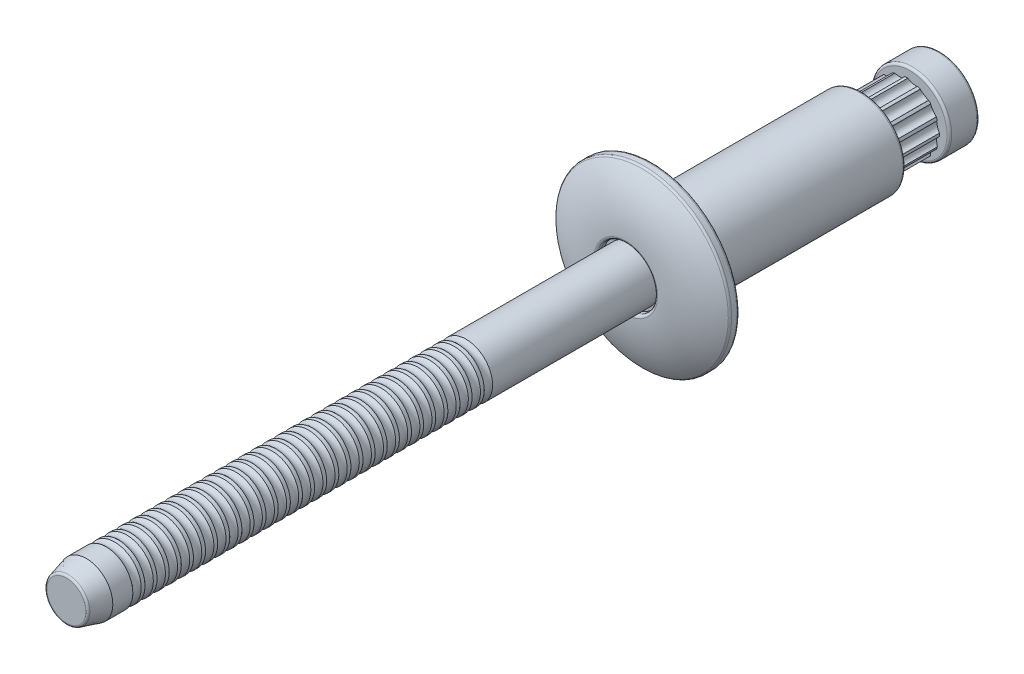
from build123d import *

# Parameters (mm, degrees)
FILLET1_R          = 0.142875
CHAMFER1_SIZE      = 0.14478
CHAMFER1_SIZE2     = 0.250766316
FILLET2_R          = 0.127
CUT_EXTRUDE1_DEPTH = 47.474786555
CIRPATTERN1_COUNT  = 16
FILLET3_R          = 0.1905


with BuildPart() as part:
    # Sketch2 → Revolve1 (revolve)
    with BuildSketch(Plane(origin=(0, 0, 0), x_dir=(0, 0, -1), z_dir=(1, 0, 0)), mode=Mode.PRIVATE) as revolve1_sk:
        with BuildLine():
            Line((6.77545, 1.59258), (6.55828, 1.59258))
            ThreePointArc((6.55828, 1.59258), (6.45590508, 1.63498508), (6.4135, 1.73736))
            ThreePointArc((6.4135, 1.73736), (6.654199565, 3.321427925), (7.35457, 4.7625))
            Line((7.35457, 4.7625), (7.8613, 4.7625))
            Line((7.8613, 4.7625), (7.8613, 2.38125))
            Line((7.8613, 2.38125), (19.2913, 2.38125))
            Line((19.2913, 2.38125), (19.2913, 1.4478))
            Line((19.2913, 1.4478), (6.77545, 1.4478))
            Line((6.77545, 1.4478), (6.77545, 1.59258))
        make_face()
    revolve(revolve1_sk.sketch.rotate(Axis((0, 0, 24.0665), (0, 0, -1)), 180), axis=Axis((0, 0, 24.0665), (0, 0, -1)))

    # Fillet1
    fillet1_edges = [part.edges().sort_by_distance(p)[0] for p in [
        (0, 4.7625, -7.35457),
        (0, 4.7625, -7.8613),
        (0, 2.38125, -19.2913),
    ]]
    fillet(fillet1_edges, radius=FILLET1_R)

    # Chamfer1
    chamfer1_edges = [part.edges().sort_by_distance(p)[0] for p in [
        (0, 1.4478, -19.2913),
    ]]
    chamfer1_side = [part.faces().sort_by_distance(p)[0] for p in [
        (0, 1.4478, -13.033375),
    ]]
    chamfer(chamfer1_edges, length=CHAMFER1_SIZE, length2=CHAMFER1_SIZE2, reference=chamfer1_side[0])

    # Fillet3
    fillet3_edges = [part.edges().sort_by_distance(p)[0] for p in [
        (0, 2.38125, -7.8613),
    ]]
    fillet(fillet3_edges, radius=FILLET3_R)


with BuildPart() as body_2:
    # Sketch3 → Revolve2 (revolve)
    with BuildSketch(Plane(origin=(0, 0, 0), x_dir=(0, 0, -1), z_dir=(1, 0, 0))):
        Polygon((-24.0665, 1.15824), (-22.985847368, 1.4478), (6.4135, 1.4478), (19.2913, 1.4478), (19.50027193, 1.80975), (21.70868807, 1.80975), (21.91766, 1.4478), (21.91766, 2.143125), (23.49787638, 2.143125), (24.0665, 1.15824), (24.0665, 0), (-24.0665, 0), align=None)
    revolve(axis=Axis((0, 0, -24.0665), (0, 0, 1)))

    # Fillet2
    fillet2_edges = [body_2.edges().sort_by_distance(p)[0] for p in [
        (0, -2.143125, -21.91766),
        (0, -2.143125, -23.49787638),
        (0, -1.15824, 24.0665),
    ]]
    fillet(fillet2_edges, radius=FILLET2_R)

    # Sketch4 → Cut-Revolve1 (revolve, cut)
    with BuildSketch(Plane(origin=(0, 0, 0), x_dir=(0, 0, -1), z_dir=(1, 0, 0))):
        with BuildLine():
            Line((-21.8948, 1.4478), (-21.8948, 1.705155474))
            Line((-21.8948, 1.705155474), (-21.4376, 1.705155474))
            Line((-21.4376, 1.705155474), (-21.4376, 1.4478))
            ThreePointArc((-21.4376, 1.4478), (-21.6662, 1.360932), (-21.8948, 1.4478))
        make_face()
        with BuildLine():
            Line((-20.7772, 1.705155474), (-20.7772, 1.4478))
            ThreePointArc((-20.7772, 1.4478), (-21.0058, 1.360932), (-21.2344, 1.4478))
            Line((-21.2344, 1.4478), (-21.2344, 1.705155474))
            Line((-21.2344, 1.705155474), (-20.7772, 1.705155474))
        make_face()
        with BuildLine():
            Line((-20.1168, 1.705155474), (-20.1168, 1.4478))
            ThreePointArc((-20.1168, 1.4478), (-20.3454, 1.360932), (-20.574, 1.4478))
            Line((-20.574, 1.4478), (-20.574, 1.705155474))
            Line((-20.574, 1.705155474), (-20.1168, 1.705155474))
        make_face()
        with BuildLine():
            Line((-19.4564, 1.705155474), (-19.4564, 1.4478))
            ThreePointArc((-19.4564, 1.4478), (-19.685, 1.360932), (-19.9136, 1.4478))
            Line((-19.9136, 1.4478), (-19.9136, 1.705155474))
            Line((-19.9136, 1.705155474), (-19.4564, 1.705155474))
        make_face()
        with BuildLine():
            Line((-18.796, 1.705155474), (-18.796, 1.4478))
            ThreePointArc((-18.796, 1.4478), (-19.0246, 1.360932), (-19.2532, 1.4478))
            Line((-19.2532, 1.4478), (-19.2532, 1.705155474))
            Line((-19.2532, 1.705155474), (-18.796, 1.705155474))
        make_face()
        with BuildLine():
            Line((-18.1356, 1.705155474), (-18.1356, 1.4478))
            ThreePointArc((-18.1356, 1.4478), (-18.3642, 1.360932), (-18.5928, 1.4478))
            Line((-18.5928, 1.4478), (-18.5928, 1.705155474))
            Line((-18.5928, 1.705155474), (-18.1356, 1.705155474))
        make_face()
        with BuildLine():
            Line((-17.4752, 1.705155474), (-17.4752, 1.4478))
            ThreePointArc((-17.4752, 1.4478), (-17.7038, 1.360932), (-17.9324, 1.4478))
            Line((-17.9324, 1.4478), (-17.9324, 1.705155474))
            Line((-17.9324, 1.705155474), (-17.4752, 1.705155474))
        make_face()
        with BuildLine():
            Line((-16.8148, 1.705155474), (-16.8148, 1.4478))
            ThreePointArc((-16.8148, 1.4478), (-17.0434, 1.360932), (-17.272, 1.4478))
            Line((-17.272, 1.4478), (-17.272, 1.705155474))
            Line((-17.272, 1.705155474), (-16.8148, 1.705155474))
        make_face()
        with BuildLine():
            Line((-16.1544, 1.705155474), (-16.1544, 1.4478))
            ThreePointArc((-16.1544, 1.4478), (-16.383, 1.360932), (-16.6116, 1.4478))
            Line((-16.6116, 1.4478), (-16.6116, 1.705155474))
            Line((-16.6116, 1.705155474), (-16.1544, 1.705155474))
        make_face()
        with BuildLine():
            Line((-15.494, 1.705155474), (-15.494, 1.4478))
            ThreePointArc((-15.494, 1.4478), (-15.7226, 1.360932), (-15.9512, 1.4478))
            Line((-15.9512, 1.4478), (-15.9512, 1.705155474))
            Line((-15.9512, 1.705155474), (-15.494, 1.705155474))
        make_face()
        with BuildLine():
            Line((-14.8336, 1.705155474), (-14.8336, 1.4478))
            ThreePointArc((-14.8336, 1.4478), (-15.0622, 1.360932), (-15.2908, 1.4478))
            Line((-15.2908, 1.4478), (-15.2908, 1.705155474))
            Line((-15.2908, 1.705155474), (-14.8336, 1.705155474))
        make_face()
        with BuildLine():
            Line((-14.1732, 1.705155474), (-14.1732, 1.4478))
            ThreePointArc((-14.1732, 1.4478), (-14.4018, 1.360932), (-14.6304, 1.4478))
            Line((-14.6304, 1.4478), (-14.6304, 1.705155474))
            Line((-14.6304, 1.705155474), (-14.1732, 1.705155474))
        make_face()
        with BuildLine():
            Line((-13.5128, 1.705155474), (-13.5128, 1.4478))
            ThreePointArc((-13.5128, 1.4478), (-13.7414, 1.360932), (-13.97, 1.4478))
            Line((-13.97, 1.4478), (-13.97, 1.705155474))
            Line((-13.97, 1.705155474), (-13.5128, 1.705155474))
        make_face()
        with BuildLine():
            Line((-12.8524, 1.705155474), (-12.8524, 1.4478))
            ThreePointArc((-12.8524, 1.4478), (-13.081, 1.360932), (-13.3096, 1.4478))
            Line((-13.3096, 1.4478), (-13.3096, 1.705155474))
            Line((-13.3096, 1.705155474), (-12.8524, 1.705155474))
        make_face()
        with BuildLine():
            Line((-12.192, 1.705155474), (-12.192, 1.4478))
            ThreePointArc((-12.192, 1.4478), (-12.4206, 1.360932), (-12.6492, 1.4478))
            Line((-12.6492, 1.4478), (-12.6492, 1.705155474))
            Line((-12.6492, 1.705155474), (-12.192, 1.705155474))
        make_face()
        with BuildLine():
            Line((-11.5316, 1.705155474), (-11.5316, 1.4478))
            ThreePointArc((-11.5316, 1.4478), (-11.7602, 1.360932), (-11.9888, 1.4478))
            Line((-11.9888, 1.4478), (-11.9888, 1.705155474))
            Line((-11.9888, 1.705155474), (-11.5316, 1.705155474))
        make_face()
        with BuildLine():
            Line((-10.8712, 1.705155474), (-10.8712, 1.4478))
            ThreePointArc((-10.8712, 1.4478), (-11.0998, 1.360932), (-11.3284, 1.4478))
            Line((-11.3284, 1.4478), (-11.3284, 1.705155474))
            Line((-11.3284, 1.705155474), (-10.8712, 1.705155474))
        make_face()
        with BuildLine():
            Line((-10.2108, 1.705155474), (-10.2108, 1.4478))
            ThreePointArc((-10.2108, 1.4478), (-10.4394, 1.360932), (-10.668, 1.4478))
            Line((-10.668, 1.4478), (-10.668, 1.705155474))
            Line((-10.668, 1.705155474), (-10.2108, 1.705155474))
        make_face()
        with BuildLine():
            Line((-9.5504, 1.705155474), (-9.5504, 1.4478))
            ThreePointArc((-9.5504, 1.4478), (-9.779, 1.360932), (-10.0076, 1.4478))
            Line((-10.0076, 1.4478), (-10.0076, 1.705155474))
            Line((-10.0076, 1.705155474), (-9.5504, 1.705155474))
        make_face()
        with BuildLine():
            Line((-8.89, 1.705155474), (-8.89, 1.4478))
            ThreePointArc((-8.89, 1.4478), (-9.1186, 1.360932), (-9.3472, 1.4478))
            Line((-9.3472, 1.4478), (-9.3472, 1.705155474))
            Line((-9.3472, 1.705155474), (-8.89, 1.705155474))
        make_face()
        with BuildLine():
            Line((-8.2296, 1.705155474), (-8.2296, 1.4478))
            ThreePointArc((-8.2296, 1.4478), (-8.4582, 1.360932), (-8.6868, 1.4478))
            Line((-8.6868, 1.4478), (-8.6868, 1.705155474))
            Line((-8.6868, 1.705155474), (-8.2296, 1.705155474))
        make_face()
        with BuildLine():
            Line((-7.5692, 1.705155474), (-7.5692, 1.4478))
            ThreePointArc((-7.5692, 1.4478), (-7.7978, 1.360932), (-8.0264, 1.4478))
            Line((-8.0264, 1.4478), (-8.0264, 1.705155474))
            Line((-8.0264, 1.705155474), (-7.5692, 1.705155474))
        make_face()
        with BuildLine():
            Line((-6.9088, 1.705155474), (-6.9088, 1.4478))
            ThreePointArc((-6.9088, 1.4478), (-7.1374, 1.360932), (-7.366, 1.4478))
            Line((-7.366, 1.4478), (-7.366, 1.705155474))
            Line((-7.366, 1.705155474), (-6.9088, 1.705155474))
        make_face()
        with BuildLine():
            Line((-6.2484, 1.705155474), (-6.2484, 1.4478))
            ThreePointArc((-6.2484, 1.4478), (-6.477, 1.360932), (-6.7056, 1.4478))
            Line((-6.7056, 1.4478), (-6.7056, 1.705155474))
            Line((-6.7056, 1.705155474), (-6.2484, 1.705155474))
        make_face()
        with BuildLine():
            Line((-5.588, 1.705155474), (-5.588, 1.4478))
            ThreePointArc((-5.588, 1.4478), (-5.8166, 1.360932), (-6.0452, 1.4478))
            Line((-6.0452, 1.4478), (-6.0452, 1.705155474))
            Line((-6.0452, 1.705155474), (-5.588, 1.705155474))
        make_face()
        with BuildLine():
            Line((-4.9276, 1.705155474), (-4.9276, 1.4478))
            ThreePointArc((-4.9276, 1.4478), (-5.1562, 1.360932), (-5.3848, 1.4478))
            Line((-5.3848, 1.4478), (-5.3848, 1.705155474))
            Line((-5.3848, 1.705155474), (-4.9276, 1.705155474))
        make_face()
        with BuildLine():
            Line((-4.2672, 1.705155474), (-4.2672, 1.4478))
            ThreePointArc((-4.2672, 1.4478), (-4.4958, 1.360932), (-4.7244, 1.4478))
            Line((-4.7244, 1.4478), (-4.7244, 1.705155474))
            Line((-4.7244, 1.705155474), (-4.2672, 1.705155474))
        make_face()
        with BuildLine():
            Line((-3.6068, 1.705155474), (-3.6068, 1.4478))
            ThreePointArc((-3.6068, 1.4478), (-3.8354, 1.360932), (-4.064, 1.4478))
            Line((-4.064, 1.4478), (-4.064, 1.705155474))
            Line((-4.064, 1.705155474), (-3.6068, 1.705155474))
        make_face()
        with BuildLine():
            Line((-2.9464, 1.705155474), (-2.9464, 1.4478))
            ThreePointArc((-2.9464, 1.4478), (-3.175, 1.360932), (-3.4036, 1.4478))
            Line((-3.4036, 1.4478), (-3.4036, 1.705155474))
            Line((-3.4036, 1.705155474), (-2.9464, 1.705155474))
        make_face()
        with BuildLine():
            Line((-2.286, 1.705155474), (-2.286, 1.4478))
            ThreePointArc((-2.286, 1.4478), (-2.5146, 1.360932), (-2.7432, 1.4478))
            Line((-2.7432, 1.4478), (-2.7432, 1.705155474))
            Line((-2.7432, 1.705155474), (-2.286, 1.705155474))
        make_face()
    revolve(axis=Axis((0, 0, -24.0665), (0, 0, 1)), mode=Mode.SUBTRACT)

    # Sketch5 → Cut-Extrude1 (cut, through all)
    with BuildSketch(Plane.XY.offset(-21.91766)):
        with BuildLine():
            ThreePointArc((-0.079846836, 1.807987706), (-0.30504791, 1.533579403), (-0.618118084, 1.700918898))
            ThreePointArc((-0.618118084, 1.700918898), (-0.35306471, 1.774976161), (-0.079846836, 1.807987706))
        make_face()
    cut_extrude1 = extrude(amount=CUT_EXTRUDE1_DEPTH, mode=Mode.SUBTRACT)

    # CirPattern1: Cut-Extrude1 ×16 about axis
    cirpattern1_axis = Axis((0, 0, 0), (0, 0, 1))
    for i in range(1, CIRPATTERN1_COUNT):
        add(cut_extrude1.rotate(cirpattern1_axis, i * 360 / CIRPATTERN1_COUNT), mode=Mode.SUBTRACT)


solid = Compound([part.part, body_2.part])
